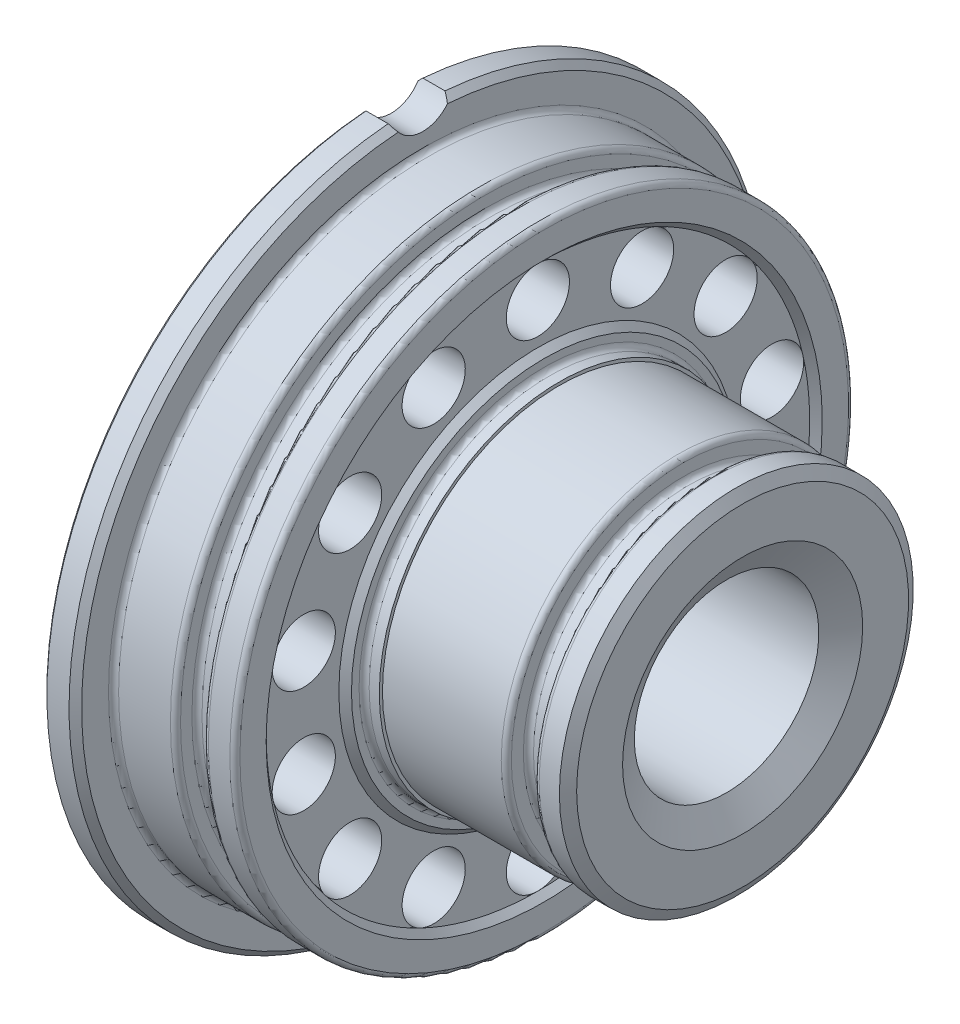
from build123d import *

# Parameters (mm, degrees)
EXTRUDE1_REACH    = 49.805
SKETCH2_R         = 2.5
EXTRUDE2_REACH    = 49.805
SKETCH3_R         = 2.5
CIRPATTERN1_COUNT = 7


with BuildPart() as part:
    # Sketch1 → Revolve1 (revolve)
    with BuildSketch(Plane.XY, mode=Mode.PRIVATE) as revolve1_sk:
        with BuildLine():
            Line((0.4, 7.3), (26.529829408, 7.3))
            Line((26.529829408, 7.3), (27.8, 9.5))
            Line((27.8, 9.5), (27.8, 13.133974596))
            Line((27.8, 13.133974596), (27.3, 14))
            Line((27.3, 14), (25.7, 14))
            ThreePointArc((25.7, 14), (25.417157288, 13.882842712), (25.3, 13.6))
            Line((25.3, 13.6), (25.3, 12.65))
            ThreePointArc((25.3, 12.65), (25.182842712, 12.367157288), (24.9, 12.25))
            Line((24.9, 12.25), (23.5, 12.25))
            ThreePointArc((23.5, 12.25), (23.217157288, 12.367157288), (23.1, 12.65))
            Line((23.1, 12.65), (23.1, 13.6))
            ThreePointArc((23.1, 13.6), (22.982842712, 13.882842712), (22.7, 14))
            Line((22.7, 14), (13.3, 14))
            Line((13.3, 14), (13.3, 14.25))
            Line((13.3, 14.25), (12.5, 14.25))
            ThreePointArc((12.5, 14.25), (12.217157288, 14.367157288), (12.1, 14.65))
            Line((12.1, 14.65), (12.1, 15.25))
            Line((12.1, 15.25), (11.6, 15.75))
            Line((11.6, 15.75), (11.6, 21.5))
            Line((11.6, 21.5), (12.1, 22))
            Line((12.1, 22), (12.1, 24.075))
            ThreePointArc((12.1, 24.075), (11.982842712, 24.357842712), (11.7, 24.475))
            Line((11.7, 24.475), (10, 24.475))
            ThreePointArc((10, 24.475), (9.717157288, 24.357842712), (9.6, 24.075))
            Line((9.6, 24.075), (9.6, 23.175))
            ThreePointArc((9.6, 23.175), (9.482842712, 22.892157288), (9.2, 22.775))
            Line((9.2, 22.775), (7.8, 22.775))
            ThreePointArc((7.8, 22.775), (7.517157288, 22.892157288), (7.4, 23.175))
            Line((7.4, 23.175), (7.4, 24.075))
            ThreePointArc((7.4, 24.075), (7.282842712, 24.357842712), (7, 24.475))
            Line((7, 24.475), (2.9, 24.475))
            ThreePointArc((2.9, 24.475), (2.617157288, 24.592157288), (2.5, 24.875))
            Line((2.5, 24.875), (2.5, 27))
            Line((2.5, 27), (2, 27.5))
            Line((2, 27.5), (0.25, 27.5))
            Line((0.25, 27.5), (0, 27.25))
            Line((0, 27.25), (0, 13.9))
            Line((0, 13.9), (0.4, 13.5))
            Line((0.4, 13.5), (0.4, 7.3))
        make_face()
    revolve(revolve1_sk.sketch.rotate(Axis((0, 0, 0), (1, 0, 0)), 90), axis=Axis((0, 0, 0), (1, 0, 0)))

    # Sketch2 → Extrude1 (cut, up to next)
    with BuildSketch(Plane.ZY, mode=Mode.PRIVATE) as extrude1_sk1:
        with Locations((0, 19)):
            Circle(SKETCH2_R)
    extrude1_tool1 = extrude(extrude1_sk1.sketch, amount=-EXTRUDE1_REACH, mode=Mode.PRIVATE) & part.part
    # Sketch2 → Extrude1 (cut, up to next)
    with BuildSketch(Plane.ZY, mode=Mode.PRIVATE) as extrude1_sk2:
        with Locations(Location((0, -19, 0), (0, 0, 269.999454858))):
            Circle(SKETCH2_R)
    extrude1_tool2 = extrude(extrude1_sk2.sketch, amount=-EXTRUDE1_REACH, mode=Mode.PRIVATE) & part.part
    extrude1_1 = extrude1_tool1.solids().sort_by_distance((0, 19, 0))[0]
    add(extrude1_1, mode=Mode.SUBTRACT)
    extrude1_2 = extrude1_tool2.solids().sort_by_distance((0, -19, 0))[0]
    add(extrude1_2, mode=Mode.SUBTRACT)
    extrude1 = extrude1_1 + extrude1_2  # Extrude1 as one shape, for the pattern or mirror that repeats it

    # Sketch3 → Extrude2 (cut, up to next)
    with BuildSketch(Plane.ZY, mode=Mode.PRIVATE) as extrude2_sk1:
        with Locations((0, 28.5)):
            Circle(SKETCH3_R)
    extrude2_tool1 = extrude(extrude2_sk1.sketch, amount=-EXTRUDE2_REACH, mode=Mode.PRIVATE) & part.part
    add(extrude2_tool1.solids().sort_by_distance((0, 28.5, 0))[0], mode=Mode.SUBTRACT)

    # CirPattern1: Extrude1 ×7 about axis
    cirpattern1_axis = Axis((0, 0, 0), (1, 0, 0))
    for i in range(1, CIRPATTERN1_COUNT):
        add(extrude1.rotate(cirpattern1_axis, i * 360 / CIRPATTERN1_COUNT), mode=Mode.SUBTRACT)


solid = part.part
